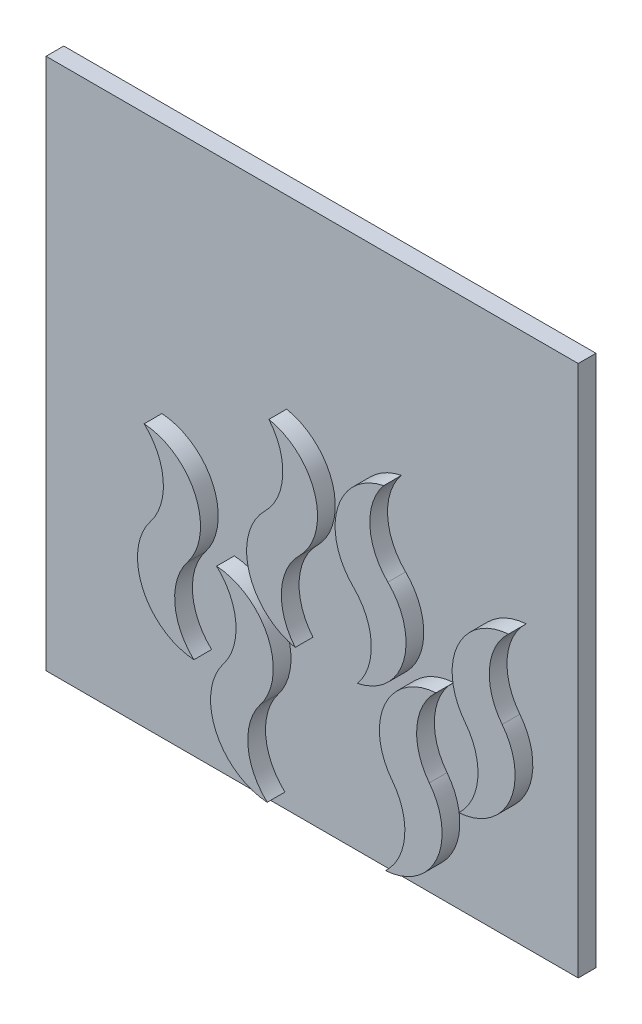
from build123d import *

# Parameters (mm, degrees)
SKICA1_W                = 300
SKICA1_H                = 300
P_IDAT_VYSUNUT_M1_DEPTH = 10
P_IDAT_VYSUNUT_M3_DEPTH = 10


with BuildPart() as part:
    # Skica1 → Přidat vysunutím1 (new body)
    with BuildSketch(Plane.XY):
        with Locations((150, 150)):
            Rectangle(SKICA1_W, SKICA1_H)
    extrude(amount=P_IDAT_VYSUNUT_M1_DEPTH)

    # Skica3 → Přidat vysunutím3 (add)
    with BuildSketch(Plane.XY.offset(10)):
        with BuildLine():
            ThreePointArc((68.888397272, 112.33931183), (64.495171116, 77.345400758), (93.328139617, 57.034463419))
            ThreePointArc((93.328139617, 57.034463419), (82.601051267, 79.285579191), (89.763558517, 102.926244737))
            ThreePointArc((89.763558517, 102.926244737), (94.156784672, 137.920155809), (65.323816172, 158.231093148))
            ThreePointArc((65.323816172, 158.231093148), (76.050904522, 135.979977376), (68.888397272, 112.33931183))
        make_face()
        with BuildLine():
            ThreePointArc((109.948101695, 63.283359984), (105.735567111, 28.267237976), (134.672993338, 8.105402458))
            ThreePointArc((134.672993338, 8.105402458), (123.831191153, 30.300850255), (130.871573598, 53.978172582))
            ThreePointArc((130.871573598, 53.978172582), (135.084108182, 88.994294591), (106.146681955, 109.156130109))
            ThreePointArc((106.146681955, 109.156130109), (116.98848414, 86.960682312), (109.948101695, 63.283359984))
        make_face()
        with BuildLine():
            ThreePointArc((133.307752162, 149.58869496), (124.467578103, 115.44597142), (150.460873085, 91.608545718))
            ThreePointArc((150.460873085, 91.608545718), (142.672820518, 115.050576661), (152.804965779, 137.578830254))
            ThreePointArc((152.804965779, 137.578830254), (161.645139837, 171.721553795), (135.651844855, 195.558979497))
            ThreePointArc((135.651844855, 195.558979497), (143.439897423, 172.116948553), (133.307752162, 149.58869496))
        make_face()
        with BuildLine():
            ThreePointArc((246.236441483, 102.926244737), (241.843215328, 137.920155809), (270.676183828, 158.231093148))
            ThreePointArc((270.676183828, 158.231093148), (259.949095478, 135.979977376), (267.111602728, 112.33931183))
            ThreePointArc((267.111602728, 112.33931183), (271.504828884, 77.345400758), (242.671860383, 57.034463419))
            ThreePointArc((242.671860383, 57.034463419), (253.398948733, 79.285579191), (246.236441483, 102.926244737))
        make_face()
        with BuildLine():
            ThreePointArc((226.051898305, 63.283359984), (230.264432889, 28.267237976), (201.327006662, 8.105402458))
            ThreePointArc((201.327006662, 8.105402458), (212.168808847, 30.300850255), (205.128426402, 53.978172582))
            ThreePointArc((205.128426402, 53.978172582), (200.915891818, 88.994294591), (229.853318045, 109.156130109))
            ThreePointArc((229.853318045, 109.156130109), (219.01151586, 86.960682312), (226.051898305, 63.283359984))
        make_face()
        with BuildLine():
            ThreePointArc((202.692247838, 149.58869496), (211.532421897, 115.44597142), (185.539126915, 91.608545718))
            ThreePointArc((185.539126915, 91.608545718), (193.327179482, 115.050576661), (183.195034221, 137.578830254))
            ThreePointArc((183.195034221, 137.578830254), (174.354860163, 171.721553795), (200.348155145, 195.558979497))
            ThreePointArc((200.348155145, 195.558979497), (192.560102577, 172.116948553), (202.692247838, 149.58869496))
        make_face()
    extrude(amount=P_IDAT_VYSUNUT_M3_DEPTH)


solid = part.part
